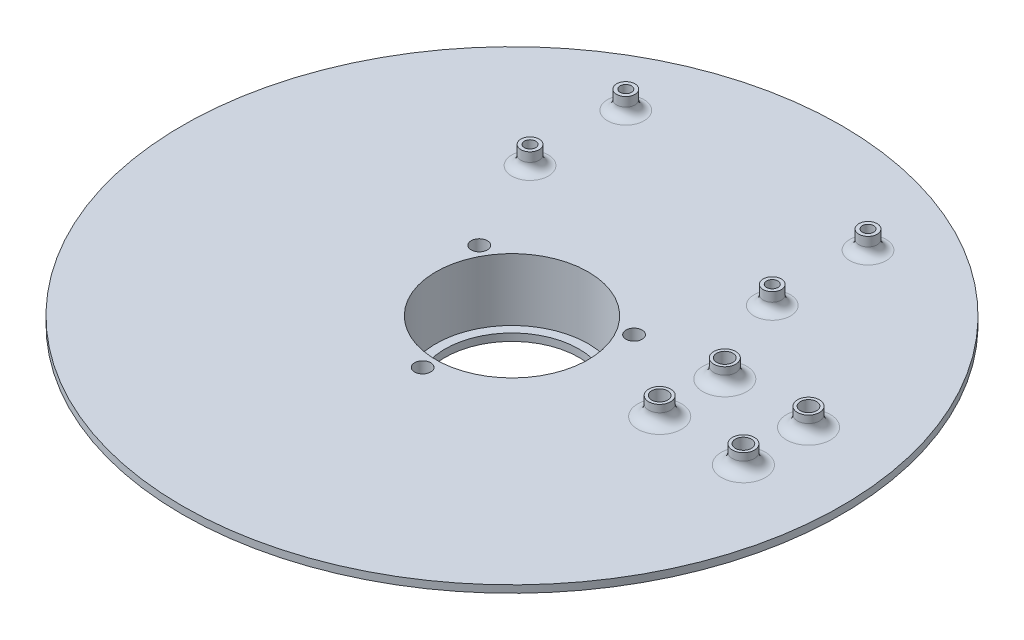
from build123d import *

# Parameters (mm, degrees)
BASE_PLATE_OUTLINE_R = 90
BOSS_EXTRUDE1_DEPTH  = 2
SKETCH3_R            = 28
BOSS_EXTRUDE2_DEPTH  = 17
SKETCH4_R            = 20.8
CUT_EXTRUDE1_DEPTH   = 129.689548915
BOSS_EXTRUDE3_START  = -2
SKETCH7_R            = 28
BOSS_EXTRUDE3_DEPTH  = 2
SKETCH8_R            = 18.3
CUT_EXTRUDE3_DEPTH   = 2
SKETCH13_R           = 2.2
CUT_EXTRUDE6_DEPTH   = 6
SKETCH9_R            = 2.5
BOSS_EXTRUDE4_DEPTH  = 5
SKETCH10_R           = 1.55
CUT_EXTRUDE4_DEPTH   = 5
FILLET1_R            = 2.5
SKETCH11_R           = 3
BOSS_EXTRUDE5_DEPTH  = 5
SKETCH12_R           = 2.2
CUT_EXTRUDE5_DEPTH   = 5
FILLET2_R            = 3


with BuildPart() as part:
    # Base Plate Outline → Boss-Extrude1 (new body)
    with BuildSketch(Plane(origin=(0, 0, 0), x_dir=(1, 0, 0), z_dir=(0, 1, 0))):
        with Locations(Location((0, 0, 0), (0, 0, 270))):
            Circle(BASE_PLATE_OUTLINE_R)
    extrude(amount=BOSS_EXTRUDE1_DEPTH)

    # Sketch3 → Boss-Extrude2 (add)
    with BuildSketch(Plane.XZ):
        with Locations(Location((0, 0, 0), (0, 0, 270))):
            Circle(SKETCH3_R)
    extrude(amount=BOSS_EXTRUDE2_DEPTH)

    # Sketch4 → Cut-Extrude1 (cut, through all)
    with BuildSketch(Plane.XZ.offset(17)):
        with Locations(Location((0, 0, 0), (0, 0, 270))):
            Circle(SKETCH4_R)
    extrude(amount=-CUT_EXTRUDE1_DEPTH, mode=Mode.SUBTRACT)

    # Sketch7 → Boss-Extrude3 (add)
    with BuildSketch(Plane.XZ.offset(17).offset(BOSS_EXTRUDE3_START)):
        with Locations(Location((0, 0, 0), (0, 0, 270))):
            Circle(SKETCH7_R)
    extrude(amount=BOSS_EXTRUDE3_DEPTH)

    # Sketch8 → Cut-Extrude3 (cut)
    with BuildSketch(Plane.XZ.offset(17)):
        with Locations(Location((0, 0, 0), (0, 0, 270))):
            Circle(SKETCH8_R)
    extrude(amount=-CUT_EXTRUDE3_DEPTH, mode=Mode.SUBTRACT)

    # Sketch13 → Cut-Extrude6 (cut)
    with BuildSketch(Plane(origin=(0, 2, 0), x_dir=(1, 0, 0), z_dir=(0, 1, 0))):
        with Locations(Location((0, -24.4, 0), (0, 0, 270))):
            Circle(SKETCH13_R)
        with Locations(Location((-21.131019852, 12.2, 0), (0, 0, 270))):
            Circle(SKETCH13_R)
        with Locations(Location((21.131019852, 12.2, 0), (0, 0, 270))):
            Circle(SKETCH13_R)
    extrude(amount=-CUT_EXTRUDE6_DEPTH, mode=Mode.SUBTRACT)

    # Sketch9 → Boss-Extrude4 (add)
    with BuildSketch(Plane(origin=(0, 2, 0), x_dir=(1, 0, 0), z_dir=(0, 1, 0))):
        with Locations(Location((-33.075, 38, 0), (0, 0, 270))):
            Circle(SKETCH9_R)
        with Locations(Location((-33.075, 64.15, 0), (0, 0, 270))):
            Circle(SKETCH9_R)
        with Locations(Location((33.075, 64.15, 0), (0, 0, 90))):
            Circle(SKETCH9_R)
        with Locations(Location((33.075, 38, 0), (0, 0, 90))):
            Circle(SKETCH9_R)
    extrude(amount=BOSS_EXTRUDE4_DEPTH)

    # Sketch10 → Cut-Extrude4 (cut)
    with BuildSketch(Plane(origin=(0, 7, 0), x_dir=(1, 0, 0), z_dir=(0, 1, 0))):
        with Locations(Location((-33.075, 38, 0), (0, 0, 270))):
            Circle(SKETCH10_R)
        with Locations(Location((-33.075, 64.15, 0), (0, 0, 270))):
            Circle(SKETCH10_R)
        with Locations(Location((33.075, 38, 0), (0, 0, 90))):
            Circle(SKETCH10_R)
        with Locations(Location((33.075, 64.15, 0), (0, 0, 90))):
            Circle(SKETCH10_R)
    extrude(amount=-CUT_EXTRUDE4_DEPTH, mode=Mode.SUBTRACT)

    # Fillet1
    fillet1_edges = [part.edges().sort_by_distance(p)[0] for p in [
        (-33.075, 2, -40.5),
        (-33.075, 2, -66.65),
        (33.075, 2, -61.65),
        (33.075, 2, -35.5),
    ]]
    fillet(fillet1_edges, radius=FILLET1_R)

    # Sketch11 → Boss-Extrude5 (add)
    with BuildSketch(Plane(origin=(0, 2, 0), x_dir=(1, 0, 0), z_dir=(0, 1, 0))):
        with Locations(Location((44, -3.667, 0), (0, 0, 270))):
            Circle(SKETCH11_R)
        with Locations(Location((44, 14.113, 0), (0, 0, 270))):
            Circle(SKETCH11_R)
        with Locations(Location((66.86, -3.667, 0), (0, 0, 90))):
            Circle(SKETCH11_R)
        with Locations(Location((66.86, 14.113, 0), (0, 0, 90))):
            Circle(SKETCH11_R)
    extrude(amount=BOSS_EXTRUDE5_DEPTH)

    # Sketch12 → Cut-Extrude5 (cut)
    with BuildSketch(Plane(origin=(0, 7, 0), x_dir=(1, 0, 0), z_dir=(0, 1, 0))):
        with Locations(Location((44, -3.667, 0), (0, 0, 270))):
            Circle(SKETCH12_R)
        with Locations(Location((44, 14.113, 0), (0, 0, 270))):
            Circle(SKETCH12_R)
        with Locations(Location((66.86, 14.113, 0), (0, 0, 270))):
            Circle(SKETCH12_R)
        with Locations(Location((66.86, -3.667, 0), (0, 0, 270))):
            Circle(SKETCH12_R)
    extrude(amount=-CUT_EXTRUDE5_DEPTH, mode=Mode.SUBTRACT)

    # Fillet2
    fillet2_edges = [part.edges().sort_by_distance(p)[0] for p in [
        (66.86, 2, -11.113),
        (44, 2, 0.667),
        (44, 2, -17.113),
        (66.86, 2, 6.667),
    ]]
    fillet(fillet2_edges, radius=FILLET2_R)


solid = part.part
